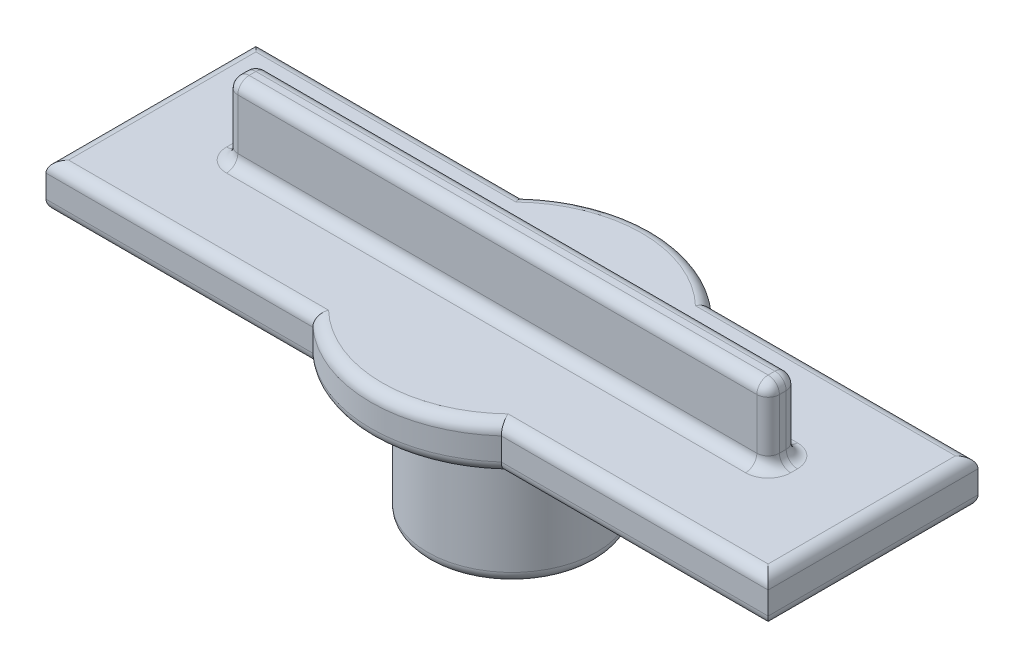
from build123d import *

# Parameters (mm, degrees)
SKETCH1_R           = 9.525
SKETCH1_R_2         = 3.175
BOSS_EXTRUDE1_DEPTH = 15.24
SKETCH2_R           = 15.875
SKETCH2_R_2         = 1.5875
BOSS_EXTRUDE2_DEPTH = 5.08
SKETCH3_W           = 60.96
SKETCH3_H           = 3.302
BOSS_EXTRUDE3_DEPTH = 8.255
SKETCH4_W           = 81.28
SKETCH4_H           = 23.622
BOSS_EXTRUDE4_DEPTH = 5.08
BOSS_EXTRUDE5_REACH = 54.155
FILLET1_R           = 1.27
FILLET2_R           = 1.27
FILLET3_R           = 1.27
FILLET4_R           = 1.27
FILLET5_R           = 3.81
FILLET6_R           = 0.635
FILLET7_R           = 1.27
FILLET8_R           = 1.27


with BuildPart() as part:
    # Sketch1 → Boss-Extrude1 (new body)
    with BuildSketch(Plane(origin=(0, 0, 0), x_dir=(1, 0, 0), z_dir=(0, 1, 0))):
        with Locations(Location((0, 0, 0), (0, 0, 90))):
            Circle(SKETCH1_R)
        with Locations(Location((0, 0, 0), (0, 0, 90))):
            Circle(SKETCH1_R_2, mode=Mode.SUBTRACT)
    extrude(amount=BOSS_EXTRUDE1_DEPTH)

    # Sketch2 → Boss-Extrude2 (add)
    with BuildSketch(Plane(origin=(0, 15.24, 0), x_dir=(1, 0, 0), z_dir=(0, 1, 0))):
        with Locations(Location((0, 0, 0), (0, 0, 270))):
            Circle(SKETCH2_R)
        with Locations(Location((0, 0, 0), (0, 0, 270))):
            Circle(SKETCH2_R_2, mode=Mode.SUBTRACT)
    extrude(amount=BOSS_EXTRUDE2_DEPTH)

    # Sketch3 → Boss-Extrude3 (add)
    with BuildSketch(Plane(origin=(0, 20.32, 0), x_dir=(1, 0, 0), z_dir=(0, 1, 0))):
        Rectangle(SKETCH3_W, SKETCH3_H)
    extrude(amount=BOSS_EXTRUDE3_DEPTH)

    # Sketch4 → Boss-Extrude4 (add)
    with BuildSketch(Plane.XZ.offset(-20.32)):
        Rectangle(SKETCH4_W, SKETCH4_H)
    extrude(amount=BOSS_EXTRUDE4_DEPTH)

    # Sketch5 → Boss-Extrude5 (add, up to next)
    with BuildSketch(Plane.XZ, mode=Mode.PRIVATE) as boss_extrude5_sk1:
        with BuildLine():
            ThreePointArc((1.905, 2.54), (0, 3.175), (-1.905, 2.54))
            Line((-1.905, 2.54), (1.905, 2.54))
        make_face()
    boss_extrude5_tool1 = extrude(boss_extrude5_sk1.sketch, amount=-BOSS_EXTRUDE5_REACH, mode=Mode.PRIVATE) - part.part
    add(boss_extrude5_tool1.solids().sort_by_distance((0, 0, 2.796311))[0])

    # Fillet1
    fillet1_edges = [part.edges().sort_by_distance(p)[0] for p in [
        (30.48, 24.4475, 1.651),
        (30.48, 24.4475, -1.651),
        (-30.48, 24.4475, -1.651),
        (-30.48, 24.4475, 1.651),
    ]]
    fillet(fillet1_edges, radius=FILLET1_R)

    # Fillet2
    fillet2_edges = [part.edges().sort_by_distance(p)[0] for p in [
        (0, 28.575, 1.651),
        (-30.48, 28.575, 0),
        (30.48, 28.575, 0),
        (0, 28.575, -1.651),
        (30.108025612, 28.575, 1.279025612),
        (30.108025612, 28.575, -1.279025612),
        (-30.108025612, 28.575, -1.279025612),
        (-30.108025612, 28.575, 1.279025612),
    ]]
    fillet(fillet2_edges, radius=FILLET2_R)

    # Fillet3
    fillet3_edges = [part.edges().sort_by_distance(p)[0] for p in [
        (0, 20.32, 15.875),
        (0, 20.32, -15.875),
        (25.623675707, 20.32, 11.811),
        (-25.623675707, 20.32, 11.811),
        (-25.623675707, 20.32, -11.811),
        (25.623675707, 20.32, -11.811),
        (40.64, 20.32, 0),
        (-40.64, 20.32, 0),
    ]]
    fillet(fillet3_edges, radius=FILLET3_R)

    # Fillet4
    fillet4_edges = [part.edges().sort_by_distance(p)[0] for p in [
        (0, 15.24, -15.875),
        (0, 15.24, 15.875),
        (25.623675707, 15.24, -11.811),
        (40.64, 15.24, 0),
        (25.623675707, 15.24, 11.811),
        (-25.623675707, 15.24, 11.811),
        (-40.64, 15.24, 0),
        (-25.623675707, 15.24, -11.811),
    ]]
    fillet(fillet4_edges, radius=FILLET4_R)

    # Fillet5
    fillet5_edges = [part.edges().sort_by_distance(p)[0] for p in [
        (0, 15.24, 9.525),
    ]]
    fillet(fillet5_edges, radius=FILLET5_R)

    # Fillet6
    fillet6_edges = [part.edges().sort_by_distance(p)[0] for p in [
        (0, 0, -3.175),
        (0, 0, 2.54),
    ]]
    fillet(fillet6_edges, radius=FILLET6_R)

    # Fillet7
    fillet7_edges = [part.edges().sort_by_distance(p)[0] for p in [
        (0, 0, 9.525),
    ]]
    fillet(fillet7_edges, radius=FILLET7_R)

    # Fillet8
    fillet8_edges = [part.edges().sort_by_distance(p)[0] for p in [
        (0, 20.32, 1.651),
        (-30.48, 20.32, 0),
        (0, 20.32, -1.651),
        (30.48, 20.32, 0),
        (-30.108025612, 20.32, 1.279025612),
        (-30.108025612, 20.32, -1.279025612),
        (30.108025612, 20.32, -1.279025612),
        (30.108025612, 20.32, 1.279025612),
    ]]
    fillet(fillet8_edges, radius=FILLET8_R)


solid = part.part
